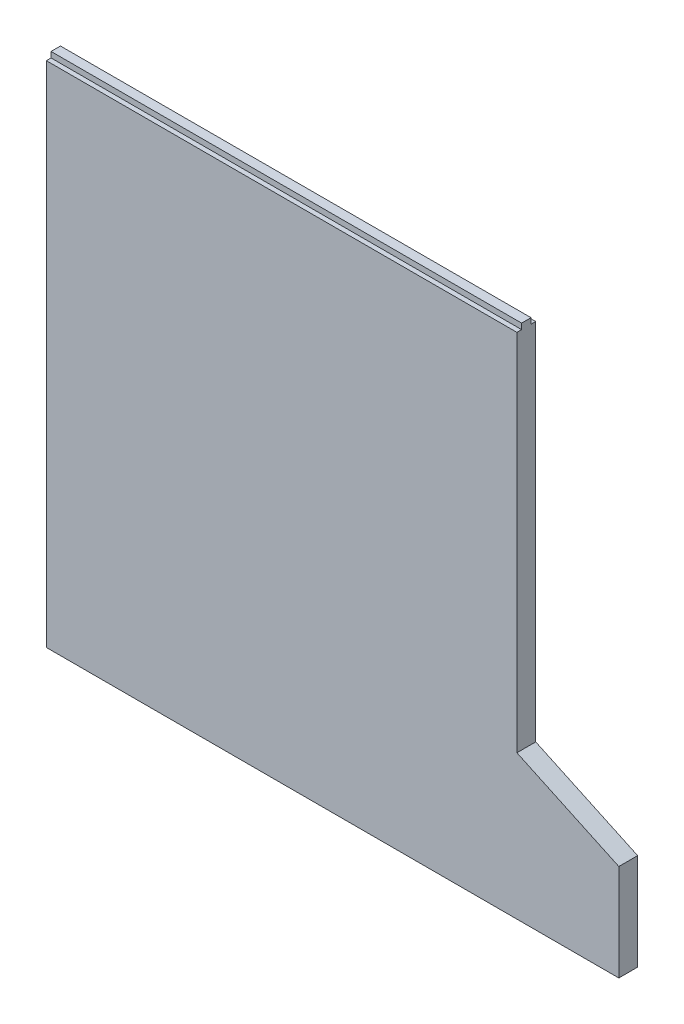
from build123d import *

# Parameters (mm, degrees)
EXTRUDE_1_DEPTH     = 10
CUT_EXTRUDE_1_DEPTH = 431.232495286


with BuildPart() as part:
    # 草圖1 → 填料-伸長1 (new body)
    with BuildSketch(Plane.XY):
        Polygon((250, 76.558764576), (304.147622093, 51.309313723), (304.147622093, 0), (154.147622093, 0), (0, 0), (0, 350), (250, 350), align=None)
    extrude(amount=EXTRUDE_1_DEPTH)

    # 草圖3 → 除料-伸長1 (cut, through all)
    with BuildSketch(Plane(origin=(250, 0, 0), x_dir=(0, 0, -1), z_dir=(1, 0, 0))):
        Polygon((0, 350), (-10, 350), (-10, 270), (-7.5, 270), (-7.5, 273), (-2.5, 273), (-2.5, 270), (0, 270), align=None)
    extrude(amount=-CUT_EXTRUDE_1_DEPTH, mode=Mode.SUBTRACT)


solid = part.part
